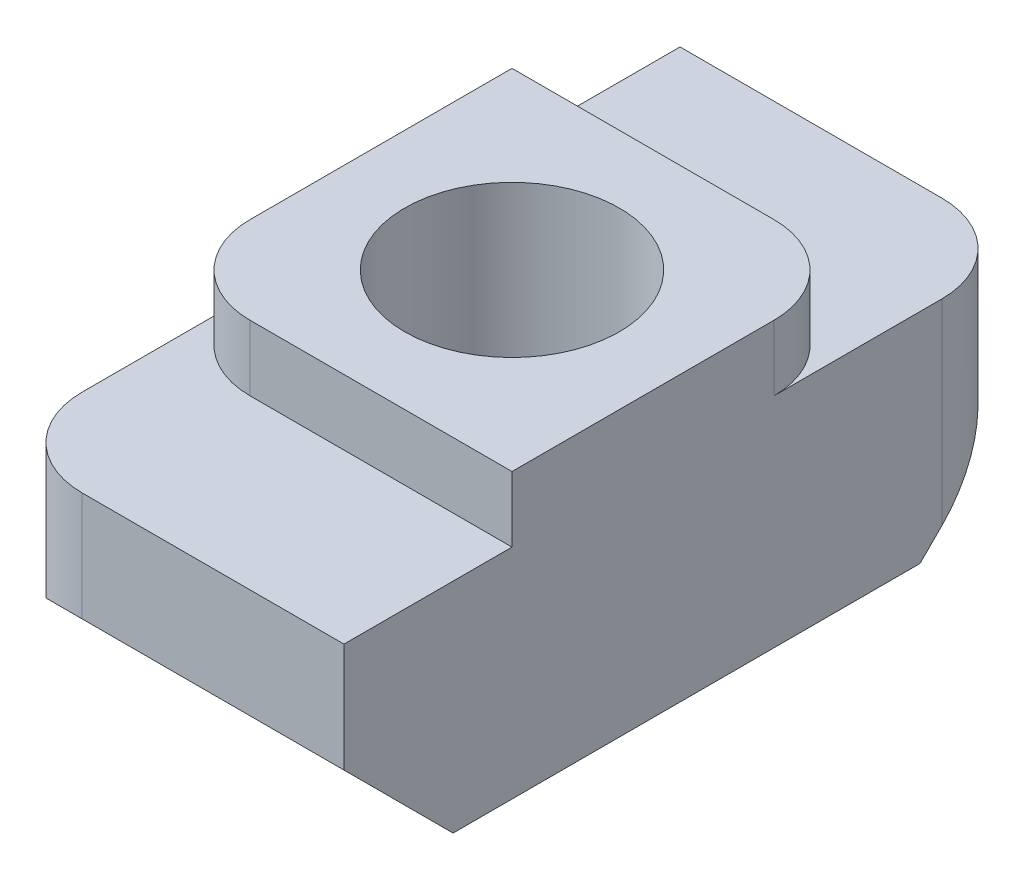
from build123d import *

# Parameters (mm, degrees)
BOSS_EXTRUDE1_DEPTH = 4
FILLET1_R           = 2
TAP1_D              = 4.917


with BuildPart() as part:
    # Sketch1 → Boss-Extrude1 (new, symmetric)
    with BuildSketch(Plane(origin=(0, 0, 0), x_dir=(0, 0, -1), z_dir=(1, 0, 0))):
        Polygon((-4, 0), (4, 0), (4, -1.5), (7.85, -1.5), (7.85, -4), (5.35, -6.5), (-5.35, -6.5), (-7.85, -4), (-7.85, -1.5), (-4, -1.5), align=None)
    extrude(amount=BOSS_EXTRUDE1_DEPTH, both=True)

    # Fillet1
    fillet1_edges = [part.edges().sort_by_distance(p)[0] for p in [
        (4, -2.75, -7.85),
        (-4, -2.75, 7.85),
        (4, -0.75, -4),
        (-4, -0.75, 4),
    ]]
    fillet(fillet1_edges, radius=FILLET1_R)

    # Tap1 (through all)
    with Locations(Plane(origin=(0, 0, 0), x_dir=(1, 0, 0), z_dir=(0, 1, 0))):
        with Locations((0, 0)):
            Hole(TAP1_D / 2)


solid = part.part
